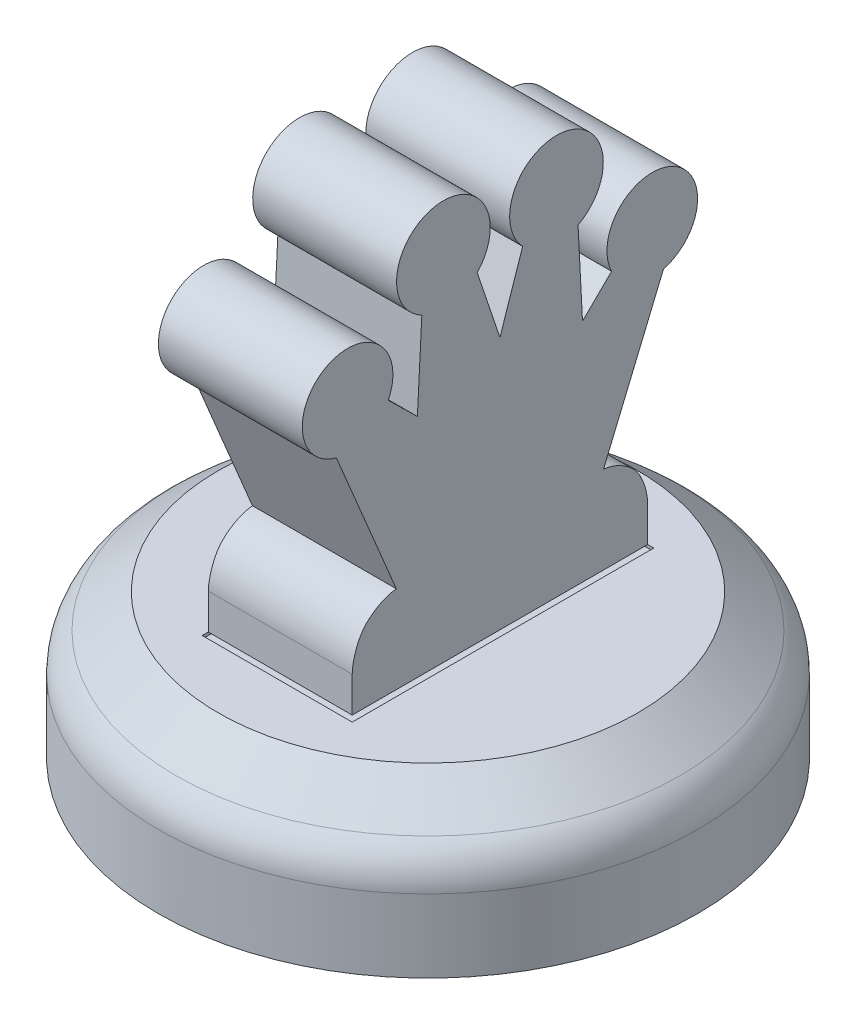
from build123d import *

# Parameters (mm, degrees)
SKETCH1_R                  = 17.859375
BOSS_EXTRUDE1_DEPTH        = 6.35
SKETCH3_W                  = 12.9032
SKETCH3_H                  = 19.2532
CUT_EXTRUDE1_DEPTH         = 4.7625
F_6_0_204_DIAMETER_HOLE1_D = 5.1816
BOSS_EXTRUDE2_DEPTH        = 4.7625
SKETCH7_W                  = 9.9314
SKETCH7_H                  = 19.9644
CUT_EXTRUDE2_DEPTH         = 0.1984375
FILLET1_R                  = 3.175


with BuildPart() as part:
    # Sketch1 → Boss-Extrude1 (new body)
    with BuildSketch(Plane(origin=(0, 0, 0), x_dir=(1, 0, 0), z_dir=(0, 1, 0))):
        with Locations(Location((0, 0, 0), (0, 0, 270))):
            Circle(SKETCH1_R)
    extrude(amount=BOSS_EXTRUDE1_DEPTH)

    # Sketch2 → Revolve1 (revolve)
    with BuildSketch(Plane.XY, mode=Mode.PRIVATE) as revolve1_sk:
        Polygon((-17.859375, 6.35), (-13.890625, 9.525), (0, 9.525), (0, 6.35), align=None)
    revolve(revolve1_sk.sketch.rotate(Axis((0, 9.525, 0), (0, -1, 0)), 270), axis=Axis((0, 9.525, 0), (0, -1, 0)))

    # Sketch3 → Cut-Extrude1 (cut)
    with BuildSketch(Plane.XZ):
        Rectangle(SKETCH3_W, SKETCH3_H)
    extrude(amount=-CUT_EXTRUDE1_DEPTH, mode=Mode.SUBTRACT)

    # #6 (0.204) Diameter Hole1 (through all)
    with Locations(Plane(origin=(0, 4.7625, 0), x_dir=(-1, 0, 0), z_dir=(0, -1, 0))):
        with Locations((0, 0)):
            Hole(F_6_0_204_DIAMETER_HOLE1_D / 2)


with BuildPart() as body_2:
    # Sketch6 → Boss-Extrude2 (new, symmetric)
    with BuildSketch(Plane(origin=(0, 0, 0), x_dir=(0, 0, -1), z_dir=(1, 0, 0))):
        with BuildLine():
            Line((-9.779, 9.525), (9.779, 9.525))
            Line((9.779, 9.525), (9.779, 12.065))
            add(Edge.make_bspline(
                [(9.779, 12.065), (9.779, 12.309468919), (9.701224749, 12.845188646), (9.453540753, 13.61203379), (9.03799011, 14.366209833), (8.40518758, 14.92489564), (7.66720928, 15.338035784), (7.129325135, 15.476256725), (6.857301174, 15.504401939)],
                knots=[0, 0, 0, 0, 0.148072564, 0.327673484, 0.488762491, 0.66561528, 0.833548992, 1, 1, 1, 1], degree=3))
            Line((6.857301174, 15.504401939), (10.828792805, 24.996727929))
            ThreePointArc((10.828792805, 24.996727929), (11.342694333, 30.627172731), (7.391685615, 26.582975214))
            Line((7.391685615, 26.582975214), (5.465367278, 24.689212217))
            Line((5.465367278, 24.689212217), (5.170285785, 30.349613138))
            ThreePointArc((5.170285785, 30.349613138), (4.248246661, 36.160523017), (1.5050265, 30.955566445))
            Line((1.5050265, 30.955566445), (0, 26.481966322))
            Line((0, 26.481966322), (-1.5050265, 30.955566445))
            ThreePointArc((-1.5050265, 30.955566445), (-4.248246661, 36.160523017), (-5.170285785, 30.349613138))
            Line((-5.170285785, 30.349613138), (-5.465367278, 24.689212217))
            Line((-5.465367278, 24.689212217), (-7.391685615, 26.582975214))
            ThreePointArc((-7.391685615, 26.582975214), (-11.342694333, 30.627172731), (-10.828792805, 24.996727929))
            Line((-10.828792805, 24.996727929), (-6.857301174, 15.504401939))
            add(Edge.make_bspline(
                [(-9.779, 12.065), (-9.779, 12.309468919), (-9.701224749, 12.845188646), (-9.453540753, 13.61203379), (-9.03799011, 14.366209833), (-8.40518758, 14.92489564), (-7.66720928, 15.338035784), (-7.129325135, 15.476256725), (-6.857301174, 15.504401939)],
                knots=[0, 0, 0, 0, 0.148072564, 0.327673484, 0.488762491, 0.66561528, 0.833548992, 1, 1, 1, 1], degree=3))
            Line((-9.779, 12.065), (-9.779, 9.525))
        make_face()
    extrude(amount=BOSS_EXTRUDE2_DEPTH, both=True)


with BuildPart() as cut_extrude2_tool:
    # Sketch7 → Cut-Extrude2 (new, symmetric)
    with BuildSketch(Plane(origin=(0, 9.525, 0), x_dir=(1, 0, 0), z_dir=(0, 1, 0))):
        Rectangle(SKETCH7_W, SKETCH7_H)
    extrude(amount=CUT_EXTRUDE2_DEPTH, both=True)


with BuildPart() as part_1:
    add(part.part)

    # Cut-Extrude2: cut by cut_extrude2_tool
    add(cut_extrude2_tool.part, mode=Mode.SUBTRACT)

    # Fillet1
    fillet1_edges = [part_1.edges().sort_by_distance(p)[0] for p in [
        (0, 6.35, -17.859375),
    ]]
    fillet(fillet1_edges, radius=FILLET1_R)


with BuildPart() as body_2_1:
    add(body_2.part)

    # Cut-Extrude2: cut by cut_extrude2_tool
    add(cut_extrude2_tool.part, mode=Mode.SUBTRACT)


solid = Compound([part_1.part, body_2_1.part])
